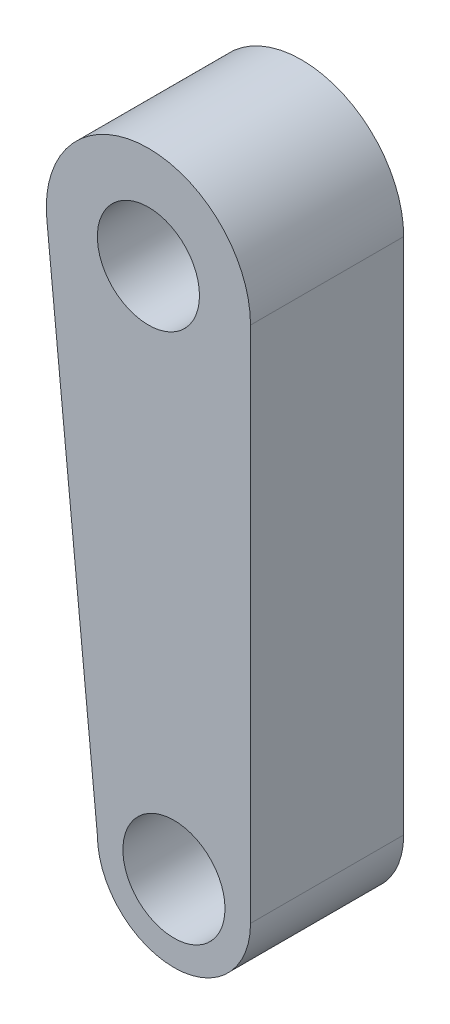
from build123d import *

# Parameters (mm, degrees)
IZIM1_R                     = 1.5
Y_KSEKLIK_EKSTR_ZYON1_DEPTH = 4.5


with BuildPart() as part:
    # Çizim1 → Yükseklik-Ekstrüzyon1 (new body)
    with BuildSketch(Plane.XY):
        with BuildLine():
            Line((-4.485257182, 3.900167122), (-3, -11.02611879))
            ThreePointArc((-3, -11.02611879), (-0.75, -13.27611879), (1.5, -11.02611879))
            Line((1.5, -11.02611879), (1.5, 4.197218558))
            ThreePointArc((1.5, 4.197218558), (-1.648708529, 7.193530587), (-4.485257182, 3.900167122))
        make_face()
        with Locations((-1.5, 4.197218558)):
            Circle(IZIM1_R, mode=Mode.SUBTRACT)
        with Locations((-0.75, -11.02611879)):
            Circle(IZIM1_R, mode=Mode.SUBTRACT)
    extrude(amount=Y_KSEKLIK_EKSTR_ZYON1_DEPTH)


solid = part.part
